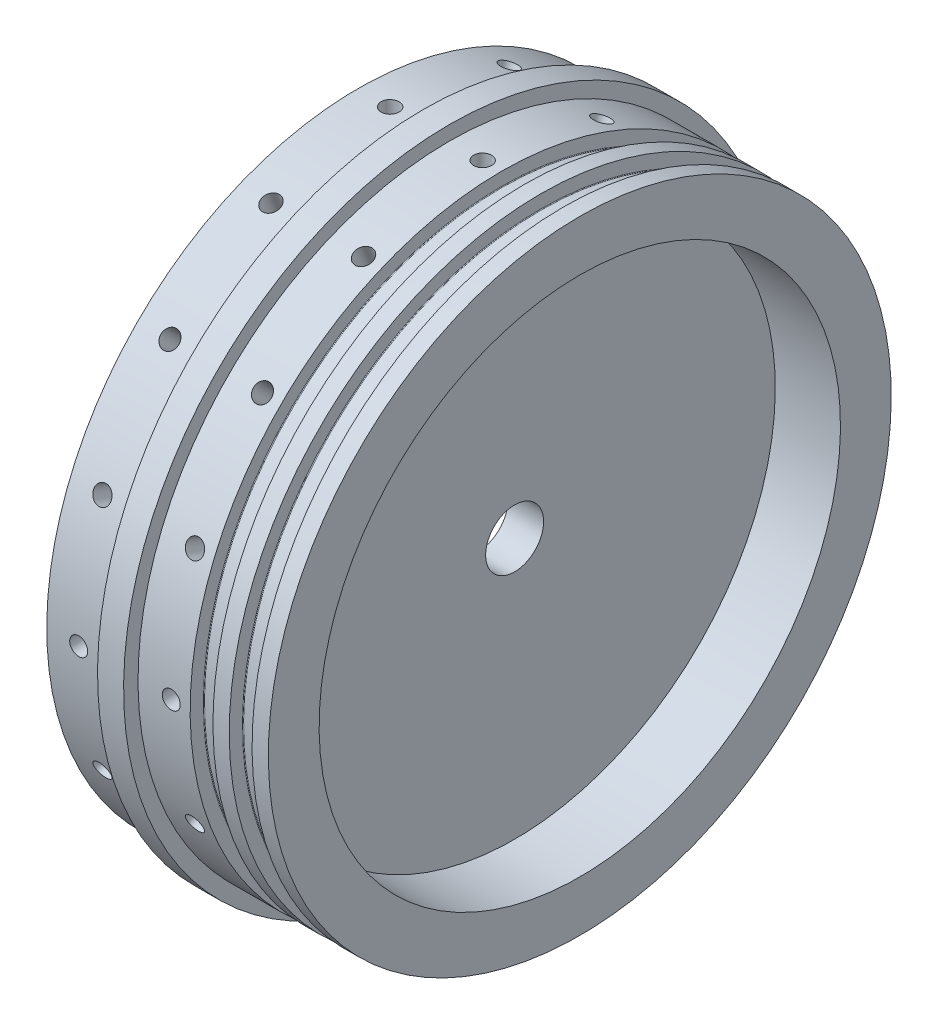
from build123d import *

# Parameters (mm, degrees)
SKETCH6_R                    = 60.6933
BOSS_EXTRUDE1_DEPTH          = 12.7
SKETCH8_R                    = 50.8
CUT_EXTRUDE1_DEPTH           = 12.7
CUT_EXTRUDE2_START           = -3.175
SKETCH9_R                    = 50.8
CUT_EXTRUDE2_DEPTH           = 3.175
SKETCH10_R                   = 42.35
CUT_EXTRUDE3_DEPTH           = 20.32
CIRPATTERN1_COUNT            = 16
F_11_2_11_3_DIAMETER_HOLE1_D = 11.3


with BuildPart() as part:
    # Sketch4 → Revolve1 (revolve)
    with BuildSketch(Plane.XY):
        with BuildLine():
            Line((0, 0), (0, 63.5))
            Line((0, 63.5), (5.08, 63.5))
            Line((5.08, 63.5), (5.08, 60.6933))
            Line((5.08, 60.6933), (15.24, 60.6933))
            Line((15.24, 60.6933), (15.24, 58.1406))
            ThreePointArc((15.24, 58.1406), (15.277197439, 58.050797439), (15.367, 58.0136))
            Line((15.367, 58.0136), (19.558, 58.0136))
            ThreePointArc((19.558, 58.0136), (19.647802561, 58.050797439), (19.685, 58.1406))
            Line((19.685, 58.1406), (19.685, 60.6933))
            Line((19.685, 60.6933), (22.86, 60.6933))
            Line((22.86, 60.6933), (22.86, 58.1406))
            ThreePointArc((22.86, 58.1406), (22.897197439, 58.050797439), (22.987, 58.0136))
            Line((22.987, 58.0136), (27.178, 58.0136))
            ThreePointArc((27.178, 58.0136), (27.267802561, 58.050797439), (27.305, 58.1406))
            Line((27.305, 58.1406), (27.305, 60.6933))
            Line((27.305, 60.6933), (30.48, 60.6933))
            Line((30.48, 60.6933), (30.48, 0))
            Line((30.48, 0), (0, 0))
        make_face()
    revolve(axis=Axis((30.48, 0, 0), (-1, 0, 0)))

    # Sketch5 → #6-32 Tapped Hole1 (revolve, cut)
    with BuildSketch(Plane(origin=(11.557, 0, 60.6933), x_dir=(0, -1, 0), z_dir=(1, 0, 0))):
        Polygon((0, 0), (0, 10.97269403), (1.35255, 10.16), (1.35255, 7.62), (1.7526, 7.62), (1.7526, 0), align=None)
    f_6_32_tapped_hole1 = revolve(axis=Axis((11.557, 0, 67.0433), (0, 0, -1)), mode=Mode.SUBTRACT)

    # Sketch6 → Boss-Extrude1 (add)
    with BuildSketch(Plane.ZY):
        with Locations(Location((0, 0, 0), (0, 0, 90))):
            Circle(SKETCH6_R)
    extrude(amount=BOSS_EXTRUDE1_DEPTH)

    # Sketch8 → Cut-Extrude1 (cut)
    with BuildSketch(Plane(origin=(30.48, 0, 0), x_dir=(0, 0, -1), z_dir=(1, 0, 0))):
        with Locations(Location((0, 0, 0), (0, 0, 90))):
            Circle(SKETCH8_R)
    extrude(amount=-CUT_EXTRUDE1_DEPTH, mode=Mode.SUBTRACT)

    # Sketch9 → Cut-Extrude2 (cut)
    with BuildSketch(Plane.ZY.offset(12.7).offset(CUT_EXTRUDE2_START)):
        with Locations(Location((0, 0, 0), (0, 0, 90))):
            Circle(SKETCH9_R)
    extrude(amount=CUT_EXTRUDE2_DEPTH, mode=Mode.SUBTRACT)

    # Sketch10 → Cut-Extrude3 (cut)
    with BuildSketch(Plane.ZY.offset(9.525)):
        with Locations(Location((0, 0, 0), (0, 0, 270))):
            Circle(SKETCH10_R)
    extrude(amount=-CUT_EXTRUDE3_DEPTH, mode=Mode.SUBTRACT)

    # CirPattern1: #6-32 Tapped Hole1 ×16 about axis
    cirpattern1_axis = Axis((0, 0, 0), (1, 0, 0))
    for i in range(1, CIRPATTERN1_COUNT):
        add(f_6_32_tapped_hole1.rotate(cirpattern1_axis, i * 360 / CIRPATTERN1_COUNT), mode=Mode.SUBTRACT)

    # Mirror1: #6-32 Tapped Hole1 across plane
    add(f_6_32_tapped_hole1.mirror(Plane.ZY.offset(-2.54)), mode=Mode.SUBTRACT)

    # Mirror1 copy 1 sketch → Mirror1 copy 1 (revolve, cut)
    with BuildSketch(Plane(origin=(-6.477, -23.226320366, 56.073297631), x_dir=(0, -0.9238795325112867, -0.3826834323650897), z_dir=(-1, 0, 0))):
        Polygon((0, 0), (0, -10.97269403), (1.35255, -10.16), (1.35255, -7.62), (1.7526, -7.62), (1.7526, 0), align=None)
    revolve(axis=Axis((-6.477, -25.656360161, 61.939932662), (0, -0.3826834323650897, 0.9238795325112867)), mode=Mode.SUBTRACT)

    # Mirror1 copy 2 sketch → Mirror1 copy 2 (revolve, cut)
    with BuildSketch(Plane(origin=(-6.477, -42.916644003, 42.916644003), x_dir=(0, -0.7071067811865476, -0.7071067811865475), z_dir=(-1, 0, 0))):
        Polygon((0, 0), (0, -10.97269403), (1.35255, -10.16), (1.35255, -7.62), (1.7526, -7.62), (1.7526, 0), align=None)
    revolve(axis=Axis((-6.477, -47.406772063, 47.406772063), (0, -0.7071067811865475, 0.7071067811865476)), mode=Mode.SUBTRACT)

    # Mirror1 copy 3 sketch → Mirror1 copy 3 (revolve, cut)
    with BuildSketch(Plane(origin=(-6.477, -56.073297631, 23.226320366), x_dir=(0, -0.3826834323650899, -0.9238795325112867), z_dir=(-1, 0, 0))):
        Polygon((0, 0), (0, -10.97269403), (1.35255, -10.16), (1.35255, -7.62), (1.7526, -7.62), (1.7526, 0), align=None)
    revolve(axis=Axis((-6.477, -61.939932662, 25.656360161), (0, -0.9238795325112867, 0.3826834323650899)), mode=Mode.SUBTRACT)

    # Mirror1 copy 4 sketch → Mirror1 copy 4 (revolve, cut)
    with BuildSketch(Plane(origin=(-6.477, -60.6933, 0), x_dir=(0, 0, -1), z_dir=(-1, 0, 0))):
        Polygon((0, 0), (0, -10.97269403), (1.35255, -10.16), (1.35255, -7.62), (1.7526, -7.62), (1.7526, 0), align=None)
    revolve(axis=Axis((-6.477, -67.0433, 0), (0, -1, 0)), mode=Mode.SUBTRACT)

    # Mirror1 copy 5 sketch → Mirror1 copy 5 (revolve, cut)
    with BuildSketch(Plane(origin=(-6.477, -56.073297631, -23.226320366), x_dir=(0, 0.38268343236508967, -0.9238795325112867), z_dir=(-1, 0, 0))):
        Polygon((0, 0), (0, -10.97269403), (1.35255, -10.16), (1.35255, -7.62), (1.7526, -7.62), (1.7526, 0), align=None)
    revolve(axis=Axis((-6.477, -61.939932662, -25.656360161), (0, -0.9238795325112867, -0.38268343236508967)), mode=Mode.SUBTRACT)

    # Mirror1 copy 6 sketch → Mirror1 copy 6 (revolve, cut)
    with BuildSketch(Plane(origin=(-6.477, -42.916644003, -42.916644003), x_dir=(0, 0.7071067811865475, -0.7071067811865476), z_dir=(-1, 0, 0))):
        Polygon((0, 0), (0, -10.97269403), (1.35255, -10.16), (1.35255, -7.62), (1.7526, -7.62), (1.7526, 0), align=None)
    revolve(axis=Axis((-6.477, -47.406772063, -47.406772063), (0, -0.7071067811865476, -0.7071067811865475)), mode=Mode.SUBTRACT)

    # Mirror1 copy 7 sketch → Mirror1 copy 7 (revolve, cut)
    with BuildSketch(Plane(origin=(-6.477, -23.226320366, -56.073297631), x_dir=(0, 0.9238795325112867, -0.38268343236508995), z_dir=(-1, 0, 0))):
        Polygon((0, 0), (0, -10.97269403), (1.35255, -10.16), (1.35255, -7.62), (1.7526, -7.62), (1.7526, 0), align=None)
    revolve(axis=Axis((-6.477, -25.656360161, -61.939932662), (0, -0.38268343236508995, -0.9238795325112867)), mode=Mode.SUBTRACT)

    # Mirror1 copy 8 sketch → Mirror1 copy 8 (revolve, cut)
    with BuildSketch(Plane(origin=(-6.477, 0, -60.6933), x_dir=(0, 1, 0), z_dir=(-1, 0, 0))):
        Polygon((0, 0), (0, -10.97269403), (1.35255, -10.16), (1.35255, -7.62), (1.7526, -7.62), (1.7526, 0), align=None)
    revolve(axis=Axis((-6.477, 0, -67.0433), (0, 0, -1)), mode=Mode.SUBTRACT)

    # Mirror1 copy 9 sketch → Mirror1 copy 9 (revolve, cut)
    with BuildSketch(Plane(origin=(-6.477, 23.226320366, -56.073297631), x_dir=(0, 0.9238795325112868, 0.3826834323650896), z_dir=(-1, 0, 0))):
        Polygon((0, 0), (0, -10.97269403), (1.35255, -10.16), (1.35255, -7.62), (1.7526, -7.62), (1.7526, 0), align=None)
    revolve(axis=Axis((-6.477, 25.656360161, -61.939932662), (0, 0.3826834323650896, -0.9238795325112868)), mode=Mode.SUBTRACT)

    # Mirror1 copy 10 sketch → Mirror1 copy 10 (revolve, cut)
    with BuildSketch(Plane(origin=(-6.477, 42.916644003, -42.916644003), x_dir=(0, 0.7071067811865477, 0.7071067811865475), z_dir=(-1, 0, 0))):
        Polygon((0, 0), (0, -10.97269403), (1.35255, -10.16), (1.35255, -7.62), (1.7526, -7.62), (1.7526, 0), align=None)
    revolve(axis=Axis((-6.477, 47.406772063, -47.406772063), (0, 0.7071067811865475, -0.7071067811865477)), mode=Mode.SUBTRACT)

    # Mirror1 copy 11 sketch → Mirror1 copy 11 (revolve, cut)
    with BuildSketch(Plane(origin=(-6.477, 56.073297631, -23.226320366), x_dir=(0, 0.38268343236508956, 0.9238795325112868), z_dir=(-1, 0, 0))):
        Polygon((0, 0), (0, -10.97269403), (1.35255, -10.16), (1.35255, -7.62), (1.7526, -7.62), (1.7526, 0), align=None)
    revolve(axis=Axis((-6.477, 61.939932662, -25.656360161), (0, 0.9238795325112868, -0.38268343236508956)), mode=Mode.SUBTRACT)

    # Mirror1 copy 12 sketch → Mirror1 copy 12 (revolve, cut)
    with BuildSketch(Plane(origin=(-6.477, 60.6933, 0), x_dir=(0, 0, 1), z_dir=(-1, 0, 0))):
        Polygon((0, 0), (0, -10.97269403), (1.35255, -10.16), (1.35255, -7.62), (1.7526, -7.62), (1.7526, 0), align=None)
    revolve(axis=Axis((-6.477, 67.0433, 0), (0, 1, 0)), mode=Mode.SUBTRACT)

    # Mirror1 copy 13 sketch → Mirror1 copy 13 (revolve, cut)
    with BuildSketch(Plane(origin=(-6.477, 56.073297631, 23.226320366), x_dir=(0, -0.38268343236508995, 0.9238795325112866), z_dir=(-1, 0, 0))):
        Polygon((0, 0), (0, -10.97269403), (1.35255, -10.16), (1.35255, -7.62), (1.7526, -7.62), (1.7526, 0), align=None)
    revolve(axis=Axis((-6.477, 61.939932662, 25.656360161), (0, 0.9238795325112866, 0.38268343236508995)), mode=Mode.SUBTRACT)

    # Mirror1 copy 14 sketch → Mirror1 copy 14 (revolve, cut)
    with BuildSketch(Plane(origin=(-6.477, 42.916644003, 42.916644003), x_dir=(0, -0.7071067811865474, 0.7071067811865477), z_dir=(-1, 0, 0))):
        Polygon((0, 0), (0, -10.97269403), (1.35255, -10.16), (1.35255, -7.62), (1.7526, -7.62), (1.7526, 0), align=None)
    revolve(axis=Axis((-6.477, 47.406772063, 47.406772063), (0, 0.7071067811865477, 0.7071067811865474)), mode=Mode.SUBTRACT)

    # Mirror1 copy 15 sketch → Mirror1 copy 15 (revolve, cut)
    with BuildSketch(Plane(origin=(-6.477, 23.226320366, 56.073297631), x_dir=(0, -0.9238795325112868, 0.3826834323650896), z_dir=(-1, 0, 0))):
        Polygon((0, 0), (0, -10.97269403), (1.35255, -10.16), (1.35255, -7.62), (1.7526, -7.62), (1.7526, 0), align=None)
    revolve(axis=Axis((-6.477, 25.656360161, 61.939932662), (0, 0.3826834323650896, 0.9238795325112868)), mode=Mode.SUBTRACT)

    # Ø11.2 (11.3) Diameter Hole1 (through all)
    with Locations(Plane.YZ.offset(17.78)):
        with Locations((0, 0)):
            Hole(F_11_2_11_3_DIAMETER_HOLE1_D / 2)


solid = part.part
